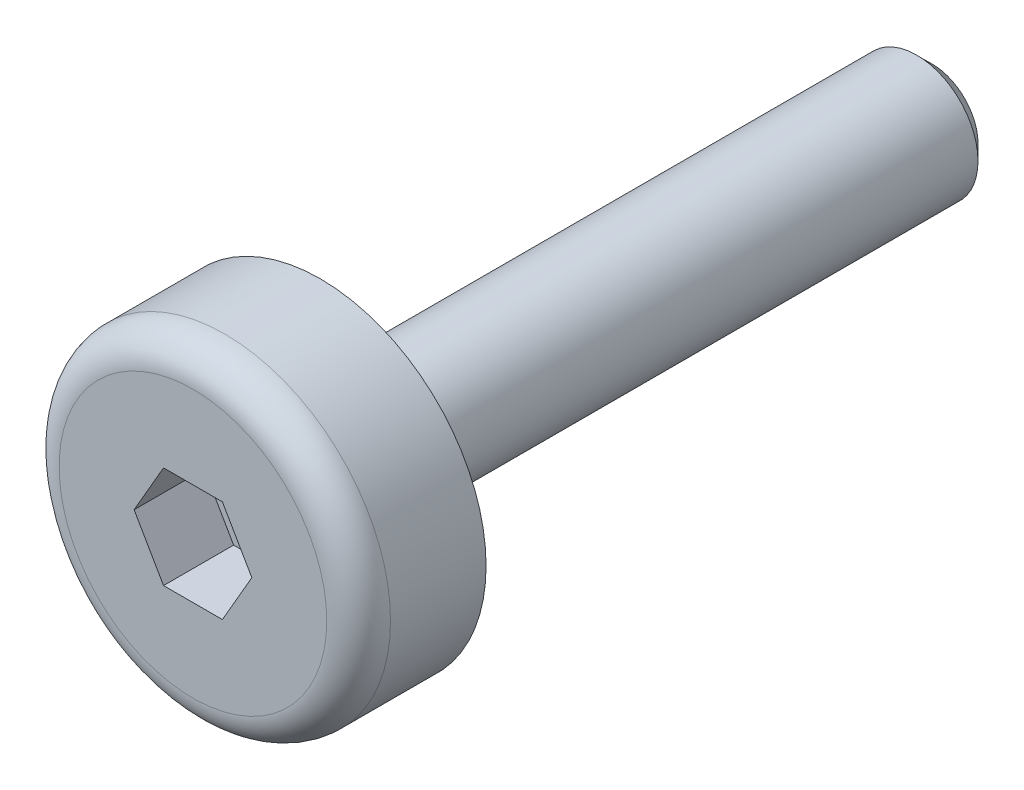
from build123d import *

# Parameters (mm, degrees)
SHANK_TIP_CHAMFER_SIZE = 0.3
PAN_HEAD_ROUND_R       = 0.625
HEX_DRIVE_CUT_DEPTH    = 1.375


with BuildPart() as part:
    # Screw Section → Screw Blank Revolve (revolve)
    with BuildSketch(Plane(origin=(0, 0, 0), x_dir=(1, 0, 0), z_dir=(0, 1, 0))):
        Polygon((0, 12), (1.2, 12), (1.2, 0), (3.25, 0), (3.25, -2.5), (0, -2.5), align=None)
    revolve(axis=Axis((0, 0, 10.123), (0, 0, -1)))

    # Shank Tip Chamfer
    shank_tip_chamfer_edges = [part.edges().sort_by_distance(p)[0] for p in [
        (-1.2, 0, -12),
    ]]
    chamfer(shank_tip_chamfer_edges, length=SHANK_TIP_CHAMFER_SIZE)

    # Pan Head Round
    pan_head_round_edges = [part.edges().sort_by_distance(p)[0] for p in [
        (-3.25, 0, 2.5),
    ]]
    fillet(pan_head_round_edges, radius=PAN_HEAD_ROUND_R)

    # Hex Drive Sketch → Hex Drive Cut (cut)
    with BuildSketch(Plane.XY.offset(2.5)):
        Polygon((1.154700538, 0), (0.577350269, 1), (-0.577350269, 1), (-1.154700538, 0), (-0.577350269, -1), (0.577350269, -1), align=None)
    extrude(amount=-HEX_DRIVE_CUT_DEPTH, mode=Mode.SUBTRACT)


solid = part.part
